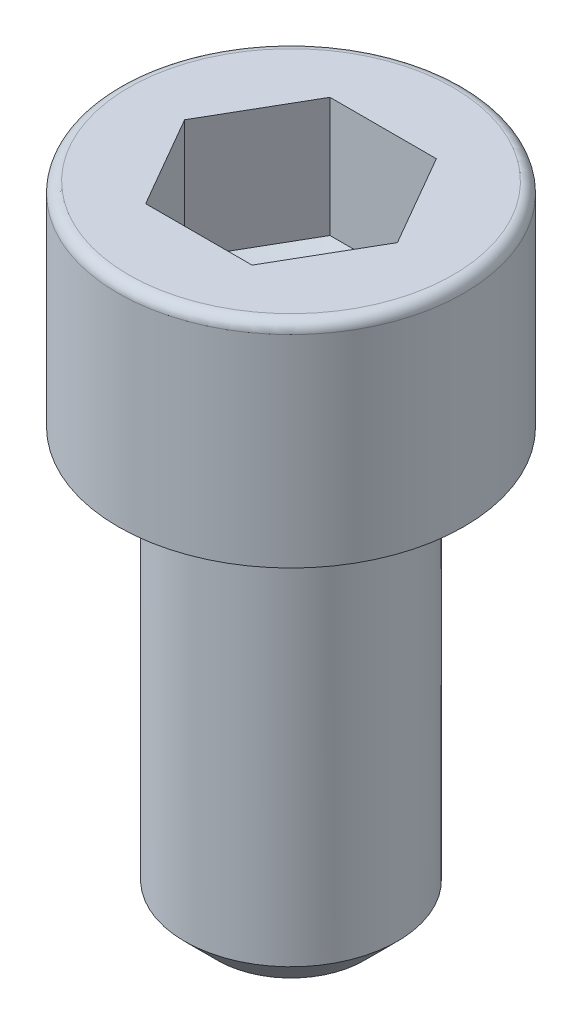
from build123d import *

# Parameters (mm, degrees)
CHAMFER1_SIZE      = 1.25
FILLET1_R          = 0.4
CUT_EXTRUDE1_DEPTH = 4.5


with BuildPart() as part:
    # Sketch1 → Revolve1 (revolve)
    with BuildSketch(Plane.XY, mode=Mode.PRIVATE) as revolve1_sk:
        Polygon((0, 0), (0, 24), (-6.5, 24), (-6.5, 16), (-4, 16), (-4, 0), align=None)
    revolve(revolve1_sk.sketch.rotate(Axis((0, 0, 0), (0, 1, 0)), 270), axis=Axis((0, 0, 0), (0, 1, 0)))

    # Chamfer1
    chamfer1_edges = [part.edges().sort_by_distance(p)[0] for p in [
        (0, 0, 4),
    ]]
    chamfer(chamfer1_edges, length=CHAMFER1_SIZE)

    # Fillet1
    fillet1_edges = [part.edges().sort_by_distance(p)[0] for p in [
        (0, 24, 6.5),
    ]]
    fillet(fillet1_edges, radius=FILLET1_R)

    # Sketch2 → Cut-Extrude1 (cut)
    with BuildSketch(Plane(origin=(0, 24, 0), x_dir=(1, 0, 0), z_dir=(0, 1, 0))):
        Polygon((-4, 0), (-2, -3.464101615), (2, -3.464101615), (4, 0), (2, 3.464101615), (-2, 3.464101615), align=None)
    extrude(amount=-CUT_EXTRUDE1_DEPTH, mode=Mode.SUBTRACT)

    # Sketch3 → Cut-Revolve1 (revolve, cut)
    with BuildSketch(Plane.XY, mode=Mode.PRIVATE) as cut_revolve1_sk:
        Polygon((4, 19.5), (0, 18.5), (0, 19.5), align=None)
    revolve(cut_revolve1_sk.sketch.rotate(Axis((0, 18.5, 0), (0, 1, 0)), 270), axis=Axis((0, 18.5, 0), (0, 1, 0)), mode=Mode.SUBTRACT)


solid = part.part
